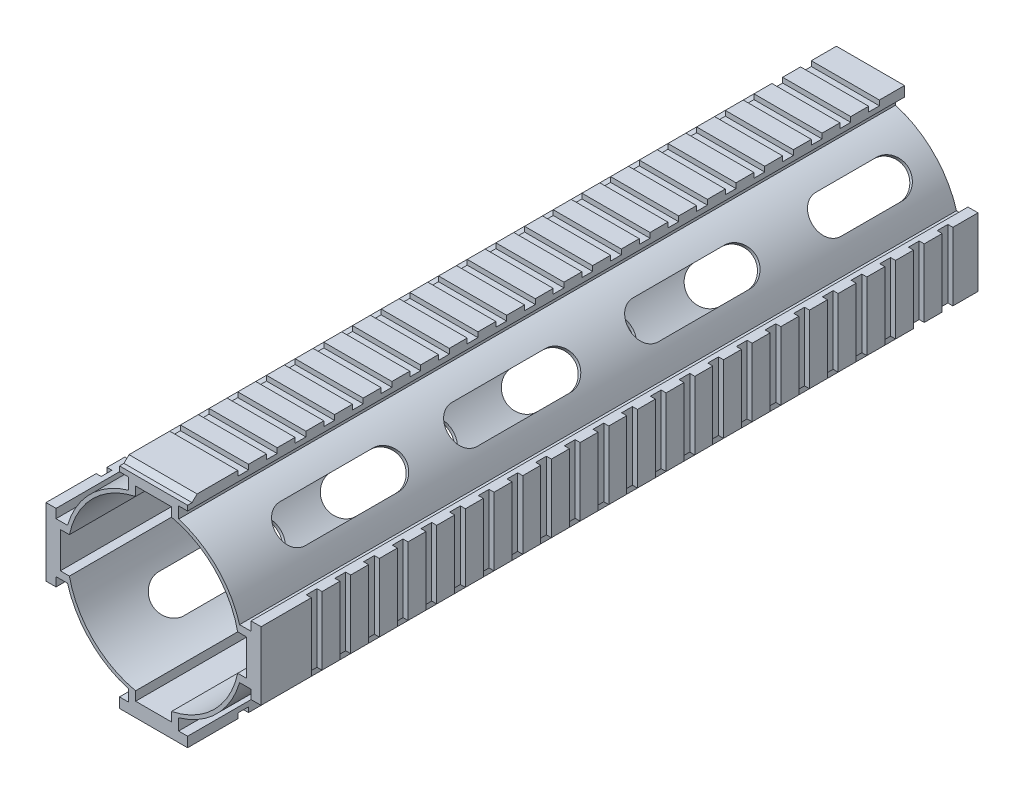
from build123d import *

# Parameters (mm, degrees)
EXTRUDE_2_DEPTH          = 200
CUT_EXTRUDE_2_DEPTH      = 210.556126843
SKETCH_6_W               = 3
SKETCH_6_H               = 1.4
CUT_EXTRUDE_3_DEPTH      = 100
CUT_EXTRUDE_4_DEPTH      = 205.4504831
CUT_EXTRUDE_4_DEPTH_BACK = 205.4504831
PATTERN_CIRCULAR_1_COUNT = 4


with BuildPart() as part:
    # 草图2 → 凸台-拉伸2 (new body)
    with BuildSketch(Plane.XY):
        with BuildLine():
            Line((7, -24), (7, -27.2))
            Line((7, -27.2), (9.5, -27.2))
            Line((9.5, -27.2), (9.5, -30))
            Line((9.5, -30), (-9.5, -30))
            Line((-9.5, -30), (-9.5, -27.2))
            Line((-9.5, -27.2), (-7, -27.2))
            Line((-7, -27.2), (-7, -24))
            ThreePointArc((-7, -24), (-17.67766953, -17.67766953), (-24, -7))
            Line((-24, -7), (-27.2, -7))
            Line((-27.2, -7), (-27.2, -9.5))
            Line((-27.2, -9.5), (-30, -9.5))
            Line((-30, -9.5), (-30, 9.5))
            Line((-30, 9.5), (-27.2, 9.5))
            Line((-27.2, 9.5), (-27.2, 7))
            Line((-27.2, 7), (-24, 7))
            ThreePointArc((-24, 7), (-17.67766953, 17.67766953), (-7, 24))
            Line((-7, 24), (-7, 27.2))
            Line((-7, 27.2), (-9.5, 27.2))
            Line((-9.5, 27.2), (-9.5, 30))
            Line((-9.5, 30), (9.5, 30))
            Line((9.5, 30), (9.5, 27.2))
            Line((9.5, 27.2), (7, 27.2))
            Line((7, 27.2), (7, 24))
            ThreePointArc((7, 24), (17.67766953, 17.67766953), (24, 7))
            Line((24, 7), (27.2, 7))
            Line((27.2, 7), (27.2, 9.5))
            Line((27.2, 9.5), (30, 9.5))
            Line((30, 9.5), (30, -9.5))
            Line((30, -9.5), (27.2, -9.5))
            Line((27.2, -9.5), (27.2, -7))
            Line((27.2, -7), (24, -7))
            ThreePointArc((24, -7), (17.67766953, -17.67766953), (7, -24))
        make_face()
        with BuildLine():
            Line((-5, 23.473389189), (-5, 26))
            Line((-5, 26), (5, 26))
            Line((5, 26), (5, 23.473389189))
            ThreePointArc((5, 23.473389189), (16.970562748, 16.970562748), (23.473389189, 5))
            Line((23.473389189, 5), (26, 5))
            Line((26, 5), (26, -5))
            Line((26, -5), (23.473389189, -5))
            ThreePointArc((23.473389189, -5), (16.970562748, -16.970562748), (5, -23.473389189))
            Line((5, -23.473389189), (5, -26))
            Line((5, -26), (-5, -26))
            Line((-5, -26), (-5, -23.473389189))
            ThreePointArc((-5, -23.473389189), (-16.970562748, -16.970562748), (-23.473389189, -5))
            Line((-23.473389189, -5), (-26, -5))
            Line((-26, -5), (-26, 5))
            Line((-26, 5), (-23.473389189, 5))
            ThreePointArc((-23.473389189, 5), (-16.970562748, 16.970562748), (-5, 23.473389189))
        make_face(mode=Mode.SUBTRACT)
    extrude(amount=-EXTRUDE_2_DEPTH)

    # 草图5 → 切除-拉伸2 (cut, through all)
    with BuildSketch(Plane(origin=(14.236694594, 14.236694594, 0), x_dir=(0.7071067811865477, -0.7071067811865474, 0), z_dir=(0.7071067811865474, 0.7071067811865477, 0))):
        with BuildLine():
            Line((5, 188), (5, 171))
            ThreePointArc((5, 171), (0, 166), (-5, 171))
            Line((-5, 171), (-5, 188))
            ThreePointArc((-5, 188), (0, 193), (5, 188))
        make_face()
        with BuildLine():
            Line((5, 145.5), (5, 120))
            ThreePointArc((5, 120), (0, 115), (-5, 120))
            Line((-5, 120), (-5, 145.5))
            ThreePointArc((-5, 145.5), (0, 150.5), (5, 145.5))
        make_face()
        with BuildLine():
            Line((5, 95.5), (5, 69.5))
            ThreePointArc((5, 69.5), (0, 64.5), (-5, 69.5))
            Line((-5, 69.5), (-5, 95.5))
            ThreePointArc((-5, 95.5), (0, 100.5), (5, 95.5))
        make_face()
        with BuildLine():
            Line((5, 47.5), (5, 21.5))
            ThreePointArc((5, 21.5), (0, 16.5), (-5, 21.5))
            Line((-5, 21.5), (-5, 47.5))
            ThreePointArc((-5, 47.5), (0, 52.5), (5, 47.5))
        make_face()
    cut_extrude_2 = extrude(amount=CUT_EXTRUDE_2_DEPTH, mode=Mode.SUBTRACT)

    # 草图6 → 切除-拉伸3 (cut, symmetric)
    with BuildSketch(Plane(origin=(0, 0, 0), x_dir=(0, 0, -1), z_dir=(1, 0, 0))):
        with Locations((191.5, 29.3)):
            Rectangle(SKETCH_6_W, SKETCH_6_H)
        with Locations((183.5, 29.3)):
            Rectangle(SKETCH_6_W, SKETCH_6_H)
        with Locations((175.5, 29.3)):
            Rectangle(SKETCH_6_W, SKETCH_6_H)
        with Locations((167.5, 29.3)):
            Rectangle(SKETCH_6_W, SKETCH_6_H)
        with Locations((159.5, 29.3)):
            Rectangle(SKETCH_6_W, SKETCH_6_H)
        with Locations((151.5, 29.3)):
            Rectangle(SKETCH_6_W, SKETCH_6_H)
        with Locations((143.5, 29.3)):
            Rectangle(SKETCH_6_W, SKETCH_6_H)
        with Locations((135.5, 29.3)):
            Rectangle(SKETCH_6_W, SKETCH_6_H)
        with Locations((127.5, 29.3)):
            Rectangle(SKETCH_6_W, SKETCH_6_H)
        with Locations((119.5, 29.3)):
            Rectangle(SKETCH_6_W, SKETCH_6_H)
        with Locations((111.5, 29.3)):
            Rectangle(SKETCH_6_W, SKETCH_6_H)
        with Locations((103.5, 29.3)):
            Rectangle(SKETCH_6_W, SKETCH_6_H)
        with Locations((95.5, 29.3)):
            Rectangle(SKETCH_6_W, SKETCH_6_H)
        with Locations((87.5, 29.3)):
            Rectangle(SKETCH_6_W, SKETCH_6_H)
        with Locations((79.5, 29.3)):
            Rectangle(SKETCH_6_W, SKETCH_6_H)
        with Locations((71.5, 29.3)):
            Rectangle(SKETCH_6_W, SKETCH_6_H)
        with Locations((63.5, 29.3)):
            Rectangle(SKETCH_6_W, SKETCH_6_H)
        with Locations((55.5, 29.3)):
            Rectangle(SKETCH_6_W, SKETCH_6_H)
        with Locations((47.5, 29.3)):
            Rectangle(SKETCH_6_W, SKETCH_6_H)
        with Locations((39.5, 29.3)):
            Rectangle(SKETCH_6_W, SKETCH_6_H)
        with Locations((31.5, 29.3)):
            Rectangle(SKETCH_6_W, SKETCH_6_H)
        with Locations((23.5, 29.3)):
            Rectangle(SKETCH_6_W, SKETCH_6_H)
        with Locations((15.5, 29.3)):
            Rectangle(SKETCH_6_W, SKETCH_6_H)
    cut_extrude_3 = extrude(amount=CUT_EXTRUDE_3_DEPTH, both=True, mode=Mode.SUBTRACT)

    # 草图7 → 切除-拉伸4 (cut, two sides: drawn at the far end of the back side and taken through both)
    with BuildSketch(Plane(origin=(0, 0, 0), x_dir=(0, 0, -1), z_dir=(1, 0, 0)).offset(-CUT_EXTRUDE_4_DEPTH_BACK)):
        Polygon((0, 28.6), (1.25, 28.6), (2.65, 30), (0, 30), align=None)
    extrude(amount=CUT_EXTRUDE_4_DEPTH + CUT_EXTRUDE_4_DEPTH_BACK, mode=Mode.SUBTRACT)

    # 阵列(圆周)1: 切除-拉伸2, 切除-拉伸3 ×4 about axis
    pattern_circular_1_axis = Axis((0, 0, 0), (0, 0, 1))
    add([cut_extrude_2.rotate(pattern_circular_1_axis, i * 360 / PATTERN_CIRCULAR_1_COUNT) for i in range(1, PATTERN_CIRCULAR_1_COUNT)], mode=Mode.SUBTRACT)
    add([cut_extrude_3.rotate(pattern_circular_1_axis, i * 360 / PATTERN_CIRCULAR_1_COUNT) for i in range(1, PATTERN_CIRCULAR_1_COUNT)], mode=Mode.SUBTRACT)


solid = part.part
